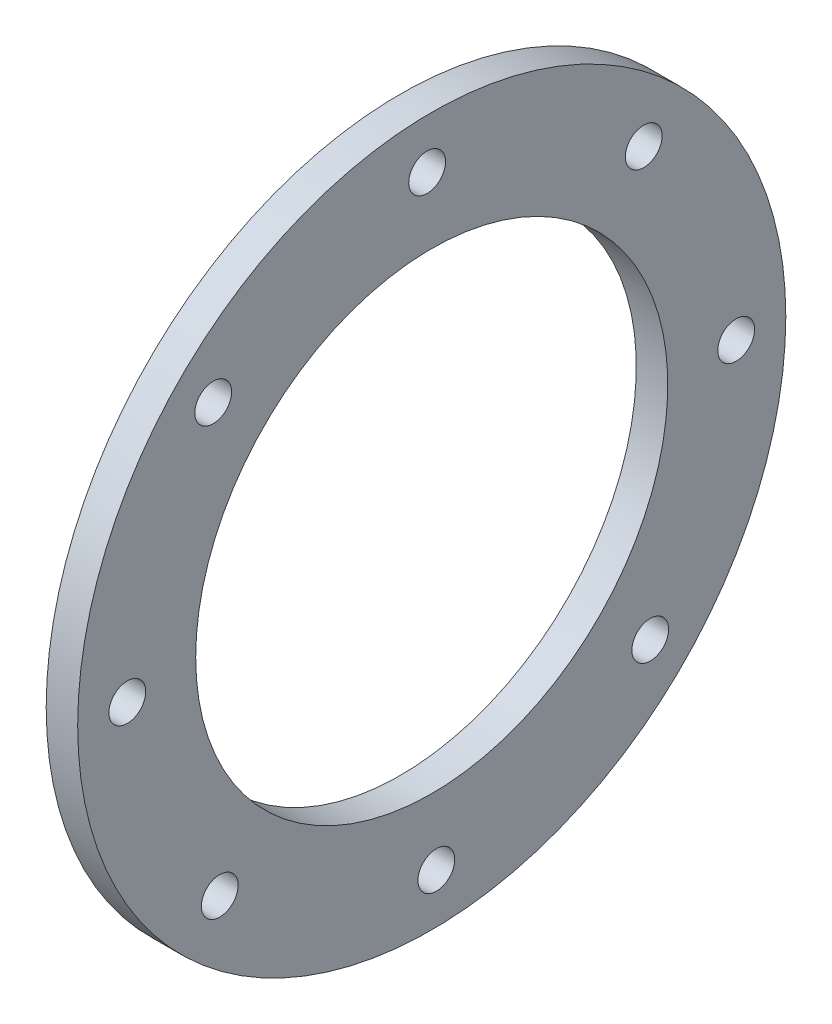
from build123d import *

# Parameters (mm, degrees)
SKETCH3_W          = 4
SKETCH3_H          = 15
SKETCH4_R          = 2.339551022
CUT_EXTRUDE1_DEPTH = 4


with BuildPart() as part:
    # Sketch3 → Revolve1 (revolve)
    with BuildSketch(Plane.XY, mode=Mode.PRIVATE) as revolve1_sk:
        with Locations((0, 37.5)):
            Rectangle(SKETCH3_W, SKETCH3_H)
    revolve(revolve1_sk.sketch.rotate(Axis((0, 0, 0), (1, 0, 0)), 90), axis=Axis((0, 0, 0), (1, 0, 0)))

    # Sketch4 → Cut-Extrude1 (cut)
    with BuildSketch(Plane.ZY.offset(2)):
        with Locations((0.585786438, 38.689785425)):
            Circle(SKETCH4_R)
        with Locations((27.772023199, 26.943596075)):
            Circle(SKETCH4_R)
        with Locations((38.689785425, -0.585786438)):
            Circle(SKETCH4_R)
        with Locations((26.943596075, -27.772023199)):
            Circle(SKETCH4_R)
        with Locations((-0.585786438, -38.689785425)):
            Circle(SKETCH4_R)
        with Locations((-27.772023199, -26.943596075)):
            Circle(SKETCH4_R)
        with Locations((-38.689785425, 0.585786438)):
            Circle(SKETCH4_R)
        with Locations((-26.943596075, 27.772023199)):
            Circle(SKETCH4_R)
    extrude(amount=-CUT_EXTRUDE1_DEPTH, mode=Mode.SUBTRACT)


solid = part.part
